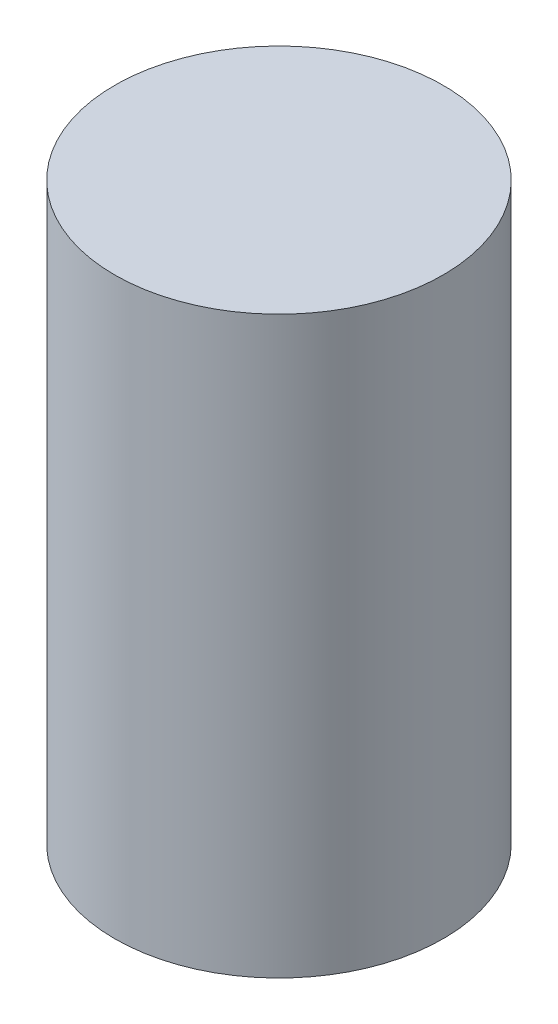
from build123d import *

# Parameters (mm, degrees)
ESQUISSE2_R        = 10
BOSS_EXTRU_2_DEPTH = 35


with BuildPart() as part:
    # Esquisse2 → Boss.-Extru.2 (new body)
    with BuildSketch(Plane(origin=(0, 0, 0), x_dir=(1, 0, 0), z_dir=(0, 1, 0))):
        with Locations(Location((0, 0, 0), (0, 0, 270))):
            Circle(ESQUISSE2_R)
    extrude(amount=BOSS_EXTRU_2_DEPTH)


solid = part.part
